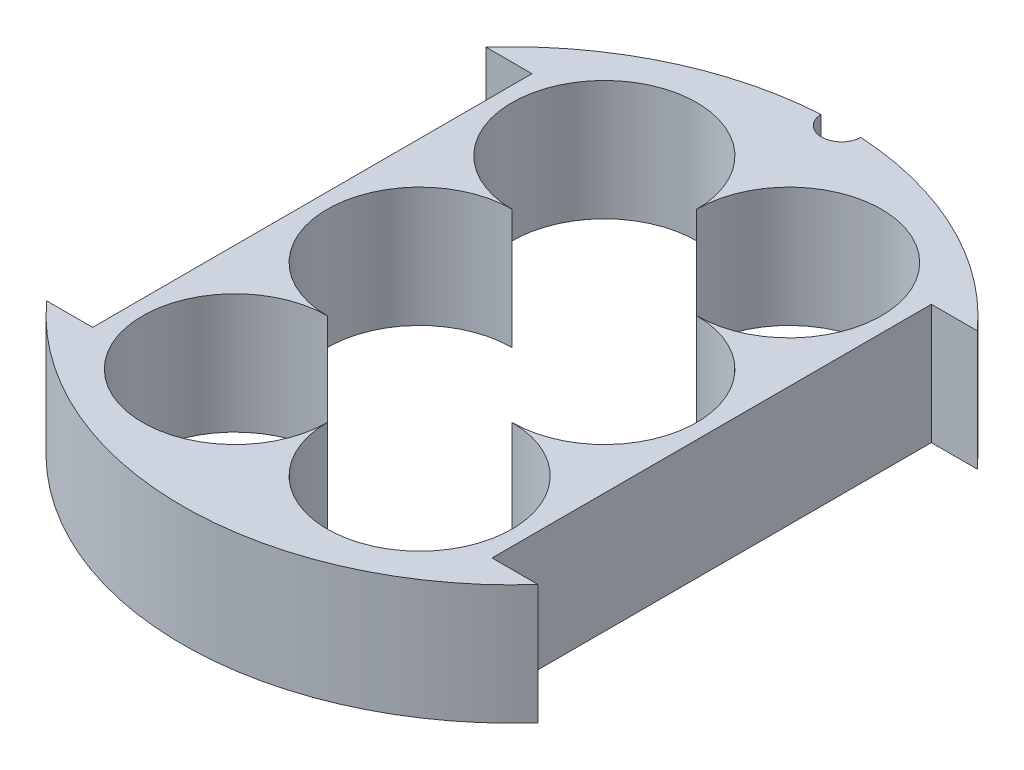
from build123d import *

# Parameters (mm, degrees)
Y_KSEKLIK_EKSTR_ZYON1_DEPTH = 12


with BuildPart() as part:
    # Çizim1 → Yükseklik-Ekstrüzyon1 (new body)
    with BuildSketch(Plane(origin=(0, 0, 0), x_dir=(1, 0, 0), z_dir=(0, 1, 0))):
        with BuildLine():
            Line((20, 0), (18.5, 0))
            ThreePointArc((18.5, 0), (15.790737726, -6.540737726), (9.25, -9.25))
            ThreePointArc((9.25, -9.25), (15.790737726, -25.040737726), (0, -18.5))
            ThreePointArc((0, -18.5), (-15.790737726, -25.040737726), (-9.25, -9.25))
            ThreePointArc((-9.25, -9.25), (-15.790737726, -6.540737726), (-18.5, 0))
            Line((-18.5, 0), (-20, 0))
            Line((-20, 0), (-20, -22))
            Line((-20, -22), (-24.596747752, -22))
            ThreePointArc((-24.596747752, -22), (0, -33), (24.596747752, -22))
            Line((24.596747752, -22), (20, -22))
            Line((20, -22), (20, 0))
        make_face()
        with BuildLine():
            ThreePointArc((9.25, 9.25), (15.790737726, 6.540737726), (18.5, 0))
            Line((18.5, 0), (20, 0))
            Line((20, 0), (20, 22))
            Line((20, 22), (24.596747752, 22))
            ThreePointArc((24.596747752, 22), (14.378877514, 29.702657818), (1.999081515, 32.939393939))
            ThreePointArc((1.999081515, 32.939393939), (0, 31), (-1.999081515, 32.939393939))
            ThreePointArc((-1.999081515, 32.939393939), (-14.378877514, 29.702657818), (-24.596747752, 22))
            Line((-24.596747752, 22), (-20, 22))
            Line((-20, 22), (-20, 0))
            Line((-20, 0), (-18.5, 0))
            ThreePointArc((-18.5, 0), (-15.790737726, 6.540737726), (-9.25, 9.25))
            ThreePointArc((-9.25, 9.25), (-15.790737726, 25.040737726), (0, 18.5))
            ThreePointArc((0, 18.5), (15.790737726, 25.040737726), (9.25, 9.25))
        make_face()
    extrude(amount=Y_KSEKLIK_EKSTR_ZYON1_DEPTH)


solid = part.part
